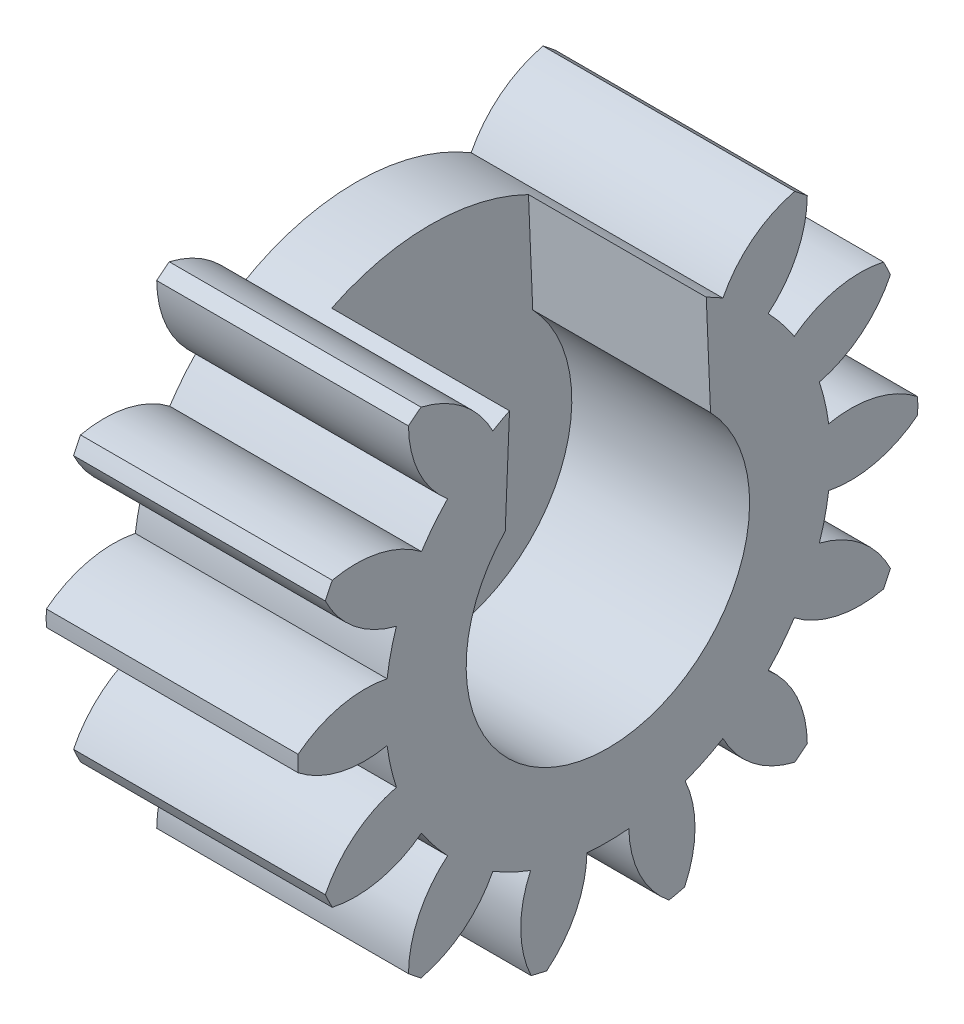
from build123d import *
from build123d.topology import SkipClean

# Parameters (mm, degrees)
SKETCH1_R           = 2
BOSS_EXTRUDE1_DEPTH = 5
SKETCH2_R           = 2
CUT_EXTRUDE1_DEPTH  = 4.59
CUT_EXTRUDE2_DEPTH  = 4.59
SKETCH4_R           = 2
BOSS_EXTRUDE2_DEPTH = 1.5
SKETCH5_R           = 2
SKETCH5_R_2         = 1.1
BOSS_EXTRUDE3_DEPTH = 1.91


with BuildPart() as part:
    # Sketch1 → Boss-Extrude1 (new body)
    with BuildSketch(Plane(origin=(-2.290735361, 0, 0), x_dir=(0, 0, -1), z_dir=(1, 0, 0))):
        with BuildLine():
            ThreePointArc((-9.21847302, -3.030854589), (-8.010225793, -3.030179432), (-6.914755008, -2.520468161))
            ThreePointArc((-6.914755008, -2.520468161), (-6.597726247, -2.958835077), (-6.240895641, -3.365461082))
            ThreePointArc((-6.240895641, -3.365461082), (-6.981592568, -4.320044698), (-7.251111098, -5.497848409))
            ThreePointArc((-7.251111098, -5.497848409), (-7.090895469, -5.629044066), (-6.927337829, -5.756048975))
            ThreePointArc((-6.927337829, -5.756048975), (-5.839037632, -5.231201855), (-5.073207991, -4.296660909))
            ThreePointArc((-5.073207991, -4.296660909), (-4.59737467, -4.554062228), (-4.099452992, -4.765596601))
            ThreePointArc((-4.099452992, -4.765596601), (-4.352619555, -5.947023074), (-4.084417482, -7.125127257))
            ThreePointArc((-4.084417482, -7.125127257), (-3.883144525, -7.173815504), (-3.680678819, -7.217277972))
            ThreePointArc((-3.680678819, -7.217277972), (-2.927876853, -6.272211298), (-2.643370309, -5.097937972))
            ThreePointArc((-2.643370309, -5.097937972), (-2.102977054, -5.123392206), (-1.562583798, -5.097937972))
            ThreePointArc((-1.562583798, -5.097937972), (-1.278077254, -6.272211298), (-0.525275288, -7.217277972))
            ThreePointArc((-0.525275288, -7.217277972), (-0.322809582, -7.173815504), (-0.121536626, -7.125127257))
            ThreePointArc((-0.121536626, -7.125127257), (0.146665447, -5.947023074), (-0.106501116, -4.765596601))
            ThreePointArc((-0.106501116, -4.765596601), (0.391420562, -4.554062228), (0.867253884, -4.296660909))
            ThreePointArc((0.867253884, -4.296660909), (1.633083524, -5.231201855), (2.721383721, -5.756048975))
            ThreePointArc((2.721383721, -5.756048975), (2.884941361, -5.629044066), (3.04515699, -5.497848409))
            ThreePointArc((3.04515699, -5.497848409), (2.77563846, -4.320044698), (2.034941533, -3.365461082))
            ThreePointArc((2.034941533, -3.365461082), (2.391772139, -2.958835077), (2.708800901, -2.520468161))
            ThreePointArc((2.708800901, -2.520468161), (3.804271685, -3.030179432), (5.012518913, -3.030854589))
            ThreePointArc((5.012518913, -3.030854589), (5.104773889, -2.845462119), (5.192199521, -2.65774396))
            ThreePointArc((5.192199521, -2.65774396), (4.438341838, -1.713519192), (3.356818658, -1.174845424))
            ThreePointArc((3.356818658, -1.174845424), (3.501883513, -0.653665056), (3.597316282, -0.121156487))
            ThreePointArc((3.597316282, -0.121156487), (4.805456786, -0.105083514), (5.894342862, 0.418547016))
            ThreePointArc((5.894342862, 0.418547016), (5.897022946, 0.625607794), (5.894342862, 0.832668571))
            ThreePointArc((5.894342862, 0.832668571), (4.805456786, 1.356299101), (3.597316282, 1.372372074))
            ThreePointArc((3.597316282, 1.372372074), (3.501883513, 1.904880643), (3.356818658, 2.426061011))
            ThreePointArc((3.356818658, 2.426061011), (4.438341838, 2.964734779), (5.192199521, 3.908959547))
            ThreePointArc((5.192199521, 3.908959547), (5.104773889, 4.096677707), (5.012518913, 4.282070176))
            ThreePointArc((5.012518913, 4.282070176), (3.804271685, 4.281395019), (2.708800901, 3.771683749))
            ThreePointArc((2.708800901, 3.771683749), (2.391772139, 4.210050664), (2.034941533, 4.616676669))
            ThreePointArc((2.034941533, 4.616676669), (2.77563846, 5.571260286), (3.04515699, 6.749063996))
            ThreePointArc((3.04515699, 6.749063996), (2.884941361, 6.880259653), (2.721383721, 7.007264562))
            ThreePointArc((2.721383721, 7.007264562), (1.633083524, 6.482417443), (0.867253884, 5.547876496))
            ThreePointArc((0.867253884, 5.547876496), (0.391420562, 5.805277815), (-0.106501116, 6.016812189))
            ThreePointArc((-0.106501116, 6.016812189), (0.146665447, 7.198238661), (-0.121536626, 8.376342845))
            ThreePointArc((-0.121536626, 8.376342845), (-0.322809582, 8.425031091), (-0.525275288, 8.46849356))
            ThreePointArc((-0.525275288, 8.46849356), (-1.278077254, 7.523426886), (-1.562583798, 6.349153559))
            ThreePointArc((-1.562583798, 6.349153559), (-2.102977054, 6.374607794), (-2.643370309, 6.349153559))
            ThreePointArc((-2.643370309, 6.349153559), (-2.927876853, 7.523426886), (-3.680678819, 8.46849356))
            ThreePointArc((-3.680678819, 8.46849356), (-3.883144525, 8.425031091), (-4.084417482, 8.376342845))
            ThreePointArc((-4.084417482, 8.376342845), (-4.352619555, 7.198238661), (-4.099452992, 6.016812189))
            ThreePointArc((-4.099452992, 6.016812189), (-4.59737467, 5.805277815), (-5.073207991, 5.547876496))
            ThreePointArc((-5.073207991, 5.547876496), (-5.839037632, 6.482417443), (-6.927337829, 7.007264562))
            ThreePointArc((-6.927337829, 7.007264562), (-7.090895469, 6.880259653), (-7.251111098, 6.749063996))
            ThreePointArc((-7.251111098, 6.749063996), (-6.981592568, 5.571260286), (-6.240895641, 4.616676669))
            ThreePointArc((-6.240895641, 4.616676669), (-6.597726247, 4.210050664), (-6.914755008, 3.771683749))
            ThreePointArc((-6.914755008, 3.771683749), (-8.010225793, 4.281395019), (-9.21847302, 4.282070176))
            ThreePointArc((-9.21847302, 4.282070176), (-9.310727997, 4.096677707), (-9.398153629, 3.908959547))
            ThreePointArc((-9.398153629, 3.908959547), (-8.644295946, 2.964734779), (-7.562772765, 2.426061011))
            ThreePointArc((-7.562772765, 2.426061011), (-7.707837621, 1.904880643), (-7.803270389, 1.372372074))
            ThreePointArc((-7.803270389, 1.372372074), (-9.011410893, 1.356299101), (-10.10029697, 0.832668571))
            ThreePointArc((-10.10029697, 0.832668571), (-10.102977054, 0.625607794), (-10.10029697, 0.418547016))
            ThreePointArc((-10.10029697, 0.418547016), (-9.011410893, -0.105083514), (-7.803270389, -0.121156487))
            ThreePointArc((-7.803270389, -0.121156487), (-7.707837621, -0.653665056), (-7.562772765, -1.174845424))
            ThreePointArc((-7.562772765, -1.174845424), (-8.644295946, -1.713519192), (-9.398153629, -2.65774396))
            ThreePointArc((-9.398153629, -2.65774396), (-9.310727997, -2.845462119), (-9.21847302, -3.030854589))
        make_face()
        with Locations(Location((-2.102977054, 0.625607794, 0), (0, 0, 180))):
            Circle(SKETCH1_R, mode=Mode.SUBTRACT)
    extrude(amount=-BOSS_EXTRUDE1_DEPTH)

    # Sketch2 → Cut-Extrude1 (cut)
    with BuildSketch(Plane(origin=(-2.290735361, 0, 0), x_dir=(0, 0, -1), z_dir=(1, 0, 0))):
        with BuildLine():
            ThreePointArc((-1.562583798, 6.349153559), (-1.832480848, 6.368240709), (-2.102977054, 6.374607794))
            ThreePointArc((-2.102977054, 6.374607794), (-2.373473259, 6.368240709), (-2.643370309, 6.349153559))
            ThreePointArc((-2.643370309, 6.349153559), (-2.927876853, 7.523426886), (-3.680678819, 8.46849356))
            ThreePointArc((-3.680678819, 8.46849356), (-3.883144525, 8.425031091), (-4.084417482, 8.376342845))
            ThreePointArc((-4.084417482, 8.376342845), (-4.352619555, 7.198238661), (-4.099452992, 6.016812189))
            ThreePointArc((-4.099452992, 6.016812189), (-4.374229098, 5.906934819), (-4.642987089, 5.783063564))
            Line((-4.642987089, 5.783063564), (-4.752977054, 3.148295163))
            ThreePointArc((-4.752977054, 3.148295163), (-2.102977054, -3.033142206), (0.547022946, 3.148295163))
            Line((0.547022946, 3.148295163), (0.437032981, 5.783063564))
            ThreePointArc((0.437032981, 5.783063564), (0.168274991, 5.906934819), (-0.106501116, 6.016812189))
            ThreePointArc((-0.106501116, 6.016812189), (0.146665447, 7.198238661), (-0.121536626, 8.376342845))
            ThreePointArc((-0.121536626, 8.376342845), (-0.322809582, 8.425031091), (-0.525275288, 8.46849356))
            ThreePointArc((-0.525275288, 8.46849356), (-1.278077254, 7.523426886), (-1.562583798, 6.349153559))
        make_face()
        with Locations((-2.102977054, 0.625607794)):
            Circle(SKETCH2_R, mode=Mode.SUBTRACT)
    extrude(amount=-CUT_EXTRUDE1_DEPTH, mode=Mode.SUBTRACT)

    # Sketch3 → Cut-Extrude2 (cut)
    with BuildSketch(Plane(origin=(-6.880735361, 0, 0), x_dir=(0, 0, -1), z_dir=(1, 0, 0))):
        with BuildLine():
            Line((-4.428262518, 5.883368582), (-5.037365747, 8.852267241))
            Line((-5.037365747, 8.852267241), (0.413398915, 8.665739173))
            Line((0.413398915, 8.665739173), (0.316720883, 5.840592251))
            ThreePointArc((0.316720883, 5.840592251), (-2.051151554, 6.374374193), (-4.428262518, 5.883368582))
        make_face()
    extrude(amount=-CUT_EXTRUDE2_DEPTH, mode=Mode.SUBTRACT)

    # Sketch4 → Boss-Extrude2 (add)
    with SkipClean():  # the faces are left unmerged after this step: merging them gives an invalid solid
        with BuildSketch(Plane.ZY.offset(7.290735361)):
            with BuildLine():
                ThreePointArc((6.927337829, 7.007264562), (5.839037632, 6.482417443), (5.073207991, 5.547876496))
                ThreePointArc((5.073207991, 5.547876496), (2.102977054, 6.374607794), (-0.867253884, 5.547876496))
                ThreePointArc((-0.867253884, 5.547876496), (-1.633083524, 6.482417443), (-2.721383721, 7.007264562))
                ThreePointArc((-2.721383721, 7.007264562), (-2.884941361, 6.880259653), (-3.04515699, 6.749063996))
                ThreePointArc((-3.04515699, 6.749063996), (-2.77563846, 5.571260286), (-2.034941533, 4.616676669))
                ThreePointArc((-2.034941533, 4.616676669), (-2.391772139, 4.210050664), (-2.708800901, 3.771683749))
                ThreePointArc((-2.708800901, 3.771683749), (-3.804271685, 4.281395019), (-5.012518913, 4.282070176))
                ThreePointArc((-5.012518913, 4.282070176), (-5.104773889, 4.096677707), (-5.192199521, 3.908959547))
                ThreePointArc((-5.192199521, 3.908959547), (-4.438341838, 2.964734779), (-3.356818658, 2.426061011))
                ThreePointArc((-3.356818658, 2.426061011), (-3.501883513, 1.904880643), (-3.597316282, 1.372372074))
                ThreePointArc((-3.597316282, 1.372372074), (-4.805456786, 1.356299101), (-5.894342862, 0.832668571))
                ThreePointArc((-5.894342862, 0.832668571), (-5.897022946, 0.625607794), (-5.894342862, 0.418547016))
                ThreePointArc((-5.894342862, 0.418547016), (-4.805456786, -0.105083514), (-3.597316282, -0.121156487))
                ThreePointArc((-3.597316282, -0.121156487), (-3.501883513, -0.653665056), (-3.356818658, -1.174845424))
                ThreePointArc((-3.356818658, -1.174845424), (-4.438341838, -1.713519192), (-5.192199521, -2.65774396))
                ThreePointArc((-5.192199521, -2.65774396), (-5.104773889, -2.845462119), (-5.012518913, -3.030854589))
                ThreePointArc((-5.012518913, -3.030854589), (-3.804271685, -3.030179432), (-2.708800901, -2.520468161))
                ThreePointArc((-2.708800901, -2.520468161), (-2.391772139, -2.958835077), (-2.034941533, -3.365461082))
                ThreePointArc((-2.034941533, -3.365461082), (-2.77563846, -4.320044698), (-3.04515699, -5.497848409))
                ThreePointArc((-3.04515699, -5.497848409), (-2.884941361, -5.629044066), (-2.721383721, -5.756048975))
                ThreePointArc((-2.721383721, -5.756048975), (-1.633083524, -5.231201855), (-0.867253884, -4.296660909))
                ThreePointArc((-0.867253884, -4.296660909), (-0.391420562, -4.554062228), (0.106501116, -4.765596601))
                ThreePointArc((0.106501116, -4.765596601), (-0.146665447, -5.947023074), (0.121536626, -7.125127257))
                ThreePointArc((0.121536626, -7.125127257), (0.322809582, -7.173815504), (0.525275288, -7.217277972))
                ThreePointArc((0.525275288, -7.217277972), (1.278077254, -6.272211298), (1.562583798, -5.097937972))
                ThreePointArc((1.562583798, -5.097937972), (2.102977054, -5.123392206), (2.643370309, -5.097937972))
                ThreePointArc((2.643370309, -5.097937972), (2.927876853, -6.272211298), (3.680678819, -7.217277972))
                ThreePointArc((3.680678819, -7.217277972), (3.883144525, -7.173815504), (4.084417482, -7.125127257))
                ThreePointArc((4.084417482, -7.125127257), (4.352619555, -5.947023074), (4.099452992, -4.765596601))
                ThreePointArc((4.099452992, -4.765596601), (4.59737467, -4.554062228), (5.073207991, -4.296660909))
                ThreePointArc((5.073207991, -4.296660909), (5.839037632, -5.231201855), (6.927337829, -5.756048975))
                ThreePointArc((6.927337829, -5.756048975), (7.090895469, -5.629044066), (7.251111098, -5.497848409))
                ThreePointArc((7.251111098, -5.497848409), (6.981592568, -4.320044698), (6.240895641, -3.365461082))
                ThreePointArc((6.240895641, -3.365461082), (6.597726247, -2.958835077), (6.914755008, -2.520468161))
                ThreePointArc((6.914755008, -2.520468161), (8.010225793, -3.030179432), (9.21847302, -3.030854589))
                ThreePointArc((9.21847302, -3.030854589), (9.310727997, -2.845462119), (9.398153629, -2.65774396))
                ThreePointArc((9.398153629, -2.65774396), (8.644295946, -1.713519192), (7.562772765, -1.174845424))
                ThreePointArc((7.562772765, -1.174845424), (7.707837621, -0.653665056), (7.803270389, -0.121156487))
                ThreePointArc((7.803270389, -0.121156487), (9.011410893, -0.105083514), (10.10029697, 0.418547016))
                ThreePointArc((10.10029697, 0.418547016), (10.102977054, 0.625607794), (10.10029697, 0.832668571))
                ThreePointArc((10.10029697, 0.832668571), (9.011410893, 1.356299101), (7.803270389, 1.372372074))
                ThreePointArc((7.803270389, 1.372372074), (7.707837621, 1.904880643), (7.562772765, 2.426061011))
                ThreePointArc((7.562772765, 2.426061011), (8.644295946, 2.964734779), (9.398153629, 3.908959547))
                ThreePointArc((9.398153629, 3.908959547), (9.310727997, 4.096677707), (9.21847302, 4.282070176))
                ThreePointArc((9.21847302, 4.282070176), (8.010225793, 4.281395019), (6.914755008, 3.771683749))
                ThreePointArc((6.914755008, 3.771683749), (6.597726247, 4.210050664), (6.240895641, 4.616676669))
                ThreePointArc((6.240895641, 4.616676669), (6.981592568, 5.571260286), (7.251111098, 6.749063996))
                ThreePointArc((7.251111098, 6.749063996), (7.090895469, 6.880259653), (6.927337829, 7.007264562))
            make_face()
            with Locations(Location((2.102977054, 0.625607794, 0), (0, 0, 180))):
                Circle(SKETCH4_R, mode=Mode.SUBTRACT)
        extrude(amount=BOSS_EXTRUDE2_DEPTH)

    # Sketch5 → Boss-Extrude3 (add, through all)
    with BuildSketch(Plane(origin=(-6.880735361, 0, 0), x_dir=(0, 0, -1), z_dir=(1, 0, 0))):
        with Locations((-2.102977054, 0.625607794)):
            Circle(SKETCH5_R)
        with Locations((-2.102977054, 0.625607794)):
            Circle(SKETCH5_R_2, mode=Mode.SUBTRACT)
    extrude(amount=-BOSS_EXTRUDE3_DEPTH)


solid = part.part
